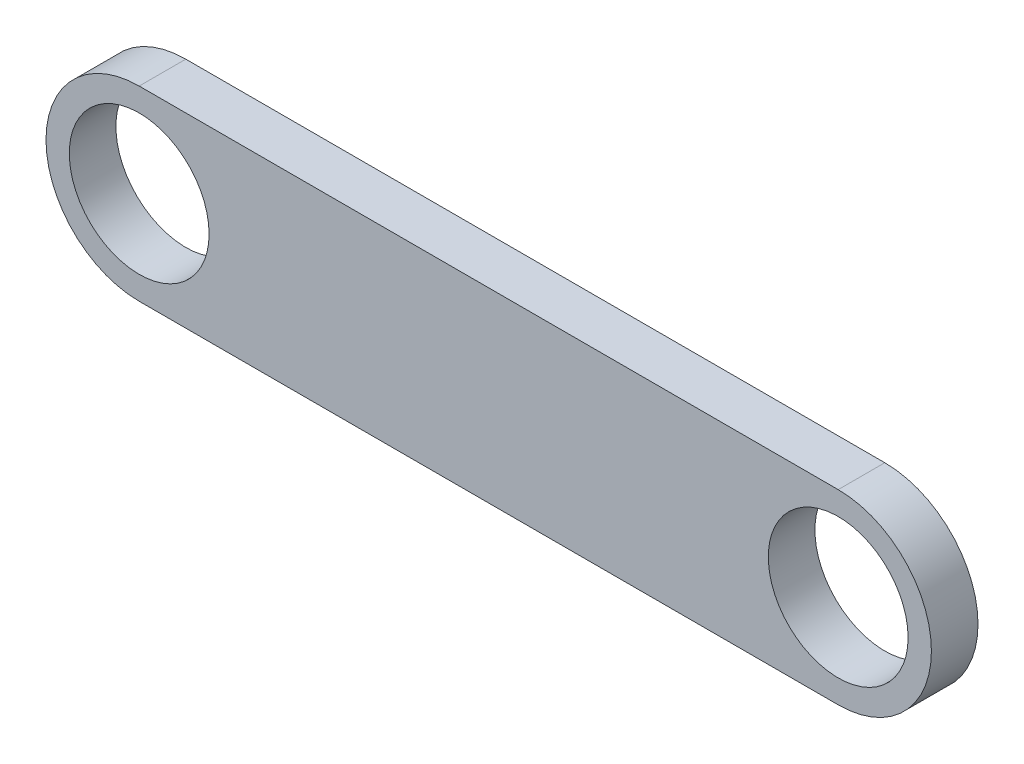
from build123d import *

# Parameters (mm, degrees)
SKETCH_1_R      = 15
EXTRUDE_1_DEPTH = 10


with BuildPart() as part:
    # Эскиз1 → Бобышка-Вытянуть1 (new body)
    with BuildSketch(Plane.XY):
        with BuildLine():
            Line((0, 20), (150, 20))
            ThreePointArc((150, 20), (170, 0), (150, -20))
            Line((150, -20), (0, -20))
            ThreePointArc((0, -20), (-20, 0), (0, 20))
        make_face()
        Circle(SKETCH_1_R, mode=Mode.SUBTRACT)
        with Locations((150, 0)):
            Circle(SKETCH_1_R, mode=Mode.SUBTRACT)
    extrude(amount=EXTRUDE_1_DEPTH)


solid = part.part
